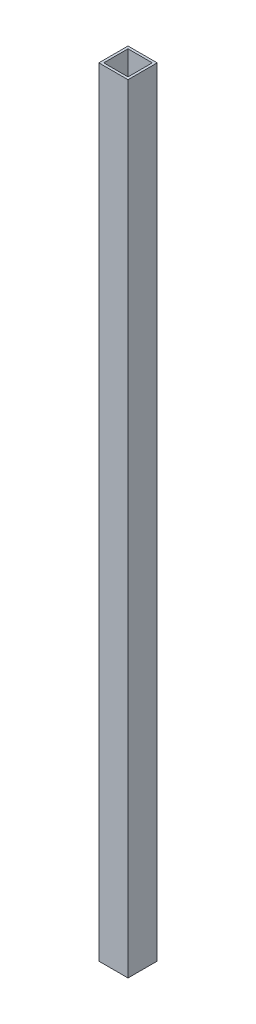
from build123d import *

# Parameters (mm, degrees)
SKETCH1_W           = 19.05
SKETCH1_H           = 19.05
SKETCH1_W_2         = 15.875
SKETCH1_H_2         = 15.875
EXTRUDE_THIN1_DEPTH = 508


with BuildPart() as part:
    # Sketch1 → Extrude-Thin1 (new body)
    with BuildSketch(Plane(origin=(0, 0, 0), x_dir=(1, 0, 0), z_dir=(0, 1, 0))):
        with Locations((9.525, 9.525)):
            Rectangle(SKETCH1_W, SKETCH1_H)
        with Locations((9.525, 9.525)):
            Rectangle(SKETCH1_W_2, SKETCH1_H_2, mode=Mode.SUBTRACT)
    extrude(amount=EXTRUDE_THIN1_DEPTH)


solid = part.part
